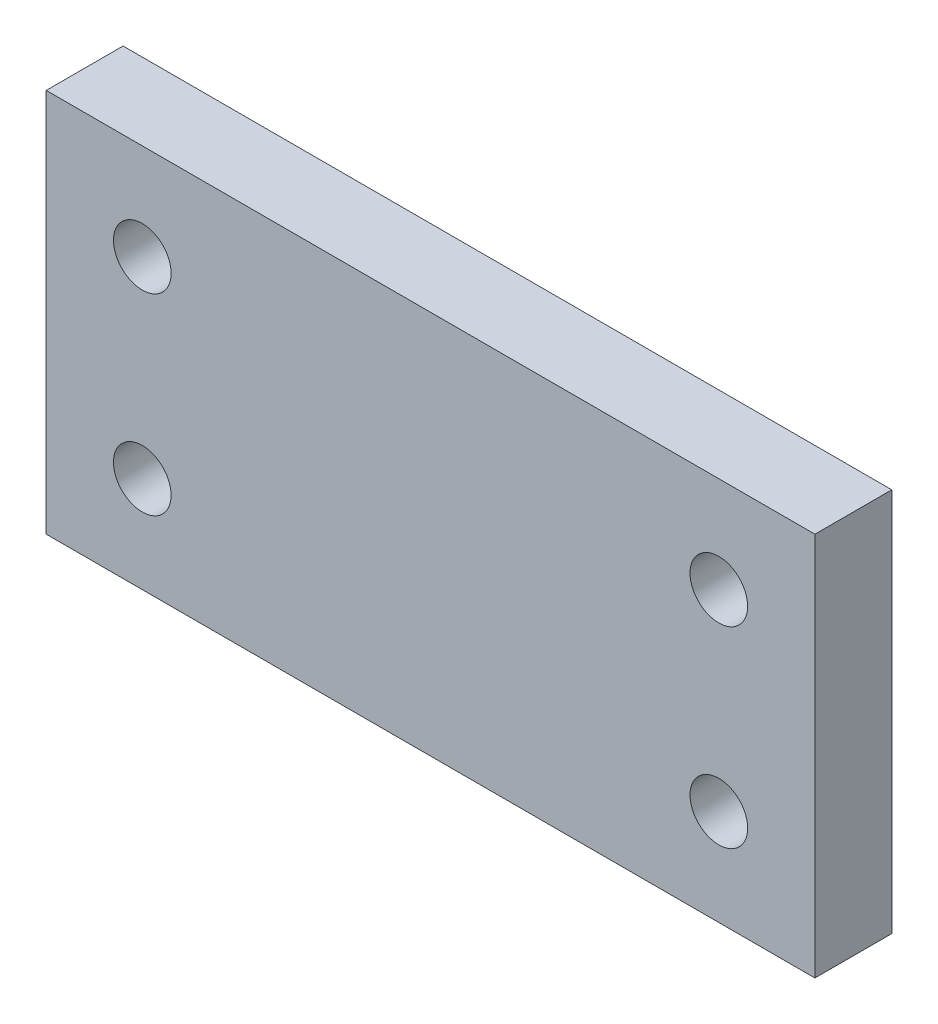
from build123d import *

# Parameters (mm, degrees)
SCHIZZO1_W                   = 80
SCHIZZO1_H                   = 40
SCHIZZO1_R                   = 3
ESTRUSIONE_ESTRUSIONE1_DEPTH = 8


with BuildPart() as part:
    # Schizzo1 → Estrusione-Estrusione1 (new body)
    with BuildSketch(Plane.XY):
        Rectangle(SCHIZZO1_W, SCHIZZO1_H)
        with Locations((-30, 10)):
            Circle(SCHIZZO1_R, mode=Mode.SUBTRACT)
        with Locations(Location((-30, -10, 0), (0, 0, 180))):
            Circle(SCHIZZO1_R, mode=Mode.SUBTRACT)
        with Locations((30, -10)):
            Circle(SCHIZZO1_R, mode=Mode.SUBTRACT)
        with Locations(Location((30, 10, 0), (0, 0, 180))):
            Circle(SCHIZZO1_R, mode=Mode.SUBTRACT)
    extrude(amount=ESTRUSIONE_ESTRUSIONE1_DEPTH)


solid = part.part
